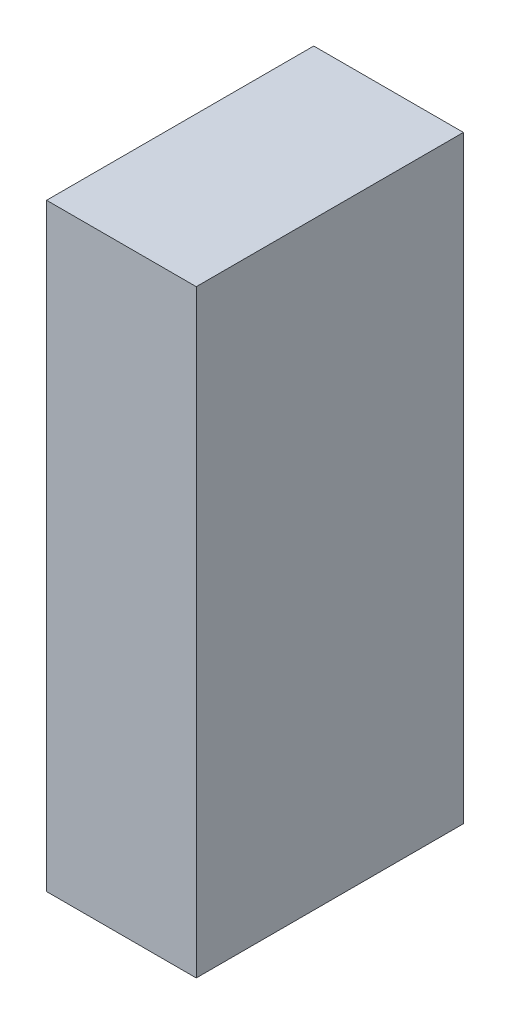
from build123d import *

# Parameters (mm, degrees)
SKETCH1_W           = 25.4
SKETCH1_H           = 101.6
BOSS_EXTRUDE1_DEPTH = 45.339


with BuildPart() as part:
    # Sketch1 → Boss-Extrude1 (new body)
    with BuildSketch(Plane.XY):
        with Locations((12.7, 50.8)):
            Rectangle(SKETCH1_W, SKETCH1_H)
    extrude(amount=BOSS_EXTRUDE1_DEPTH)


solid = part.part
